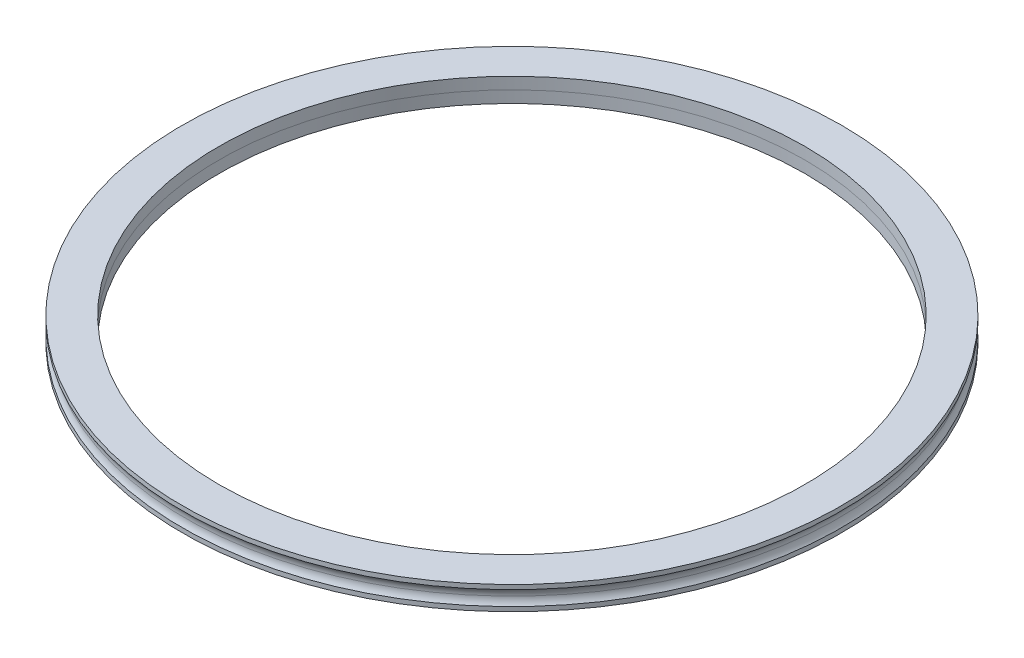
from build123d import *


with BuildPart() as part:
    # Sketch1 → Revolve1 (revolve)
    with BuildSketch(Plane.XY, mode=Mode.PRIVATE) as revolve1_sk:
        with BuildLine():
            Line((-67.5, 12.0475), (-67.5, 12.9625))
            Line((-67.5, 12.9625), (-60, 12.9625))
            Line((-60, 12.9625), (-60, 8.1325))
            Line((-60, 8.1325), (-67.5, 8.1325))
            Line((-67.5, 8.1325), (-67.5, 9.0475))
            ThreePointArc((-67.5, 9.0475), (-67, 10.5475), (-67.5, 12.0475))
        make_face()
    revolve(revolve1_sk.sketch.rotate(Axis((0, -200069.047495165, 0), (0, 1, 0)), 270), axis=Axis((0, -200069.047495165, 0), (0, 1, 0)))


with BuildPart() as body_2:
    # Split1: the piece on the far side of the plane
    add(part.part)
    split(bisect_by=Plane.ZX.offset(10.5475), keep=Keep.BOTTOM)


with BuildPart() as part_1:
    add(part.part)

    # Split1
    split(bisect_by=Plane.ZX.offset(10.5475), keep=Keep.TOP)


solid = Compound([body_2.part, part_1.part])
